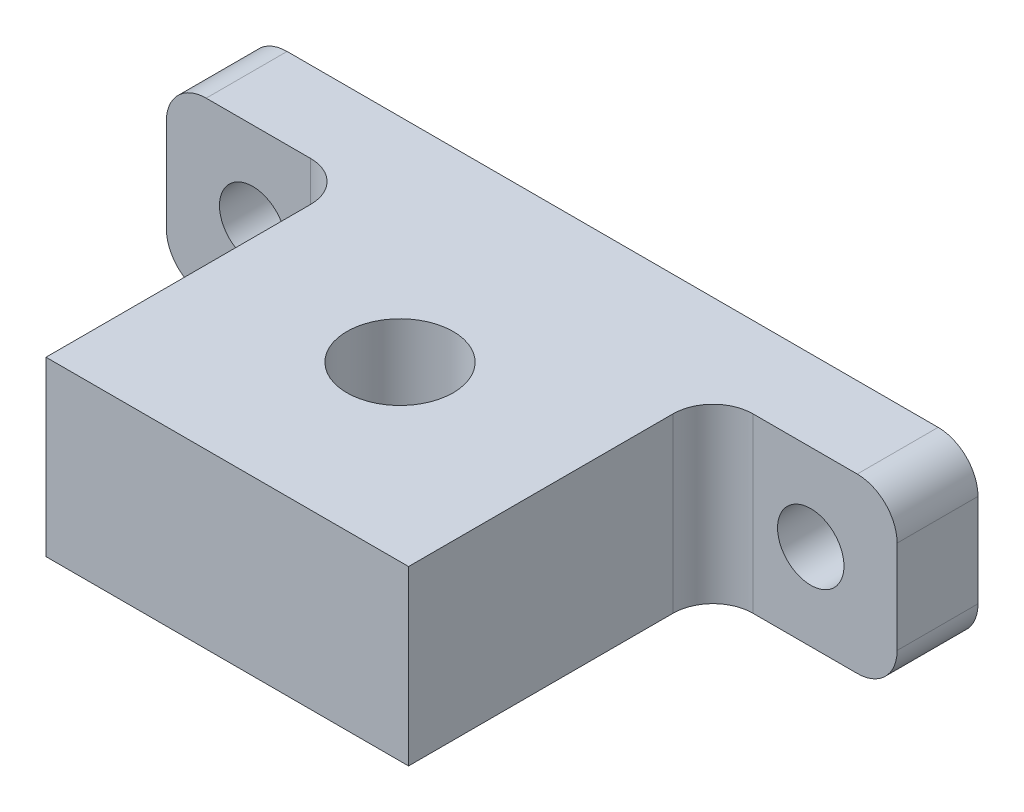
from build123d import *

# Parameters (mm, degrees)
ESBO_O2_R                = 2.5
RESSALTO_EXTRUS_O1_DEPTH = 29
ESBO_O3_R                = 4
CORTE_EXTRUS_O1_DEPTH    = 43.026777178


with BuildPart() as part:
    # Esboço2 → Ressalto-extrusão1 (new body)
    with BuildSketch(Plane.XY):
        with BuildLine():
            Line((-27.5, -3.5), (-27.5, 3.5))
            ThreePointArc((-27.5, 3.5), (-26.621320344, 5.621320344), (-24.5, 6.5))
            Line((-24.5, 6.5), (24.5, 6.5))
            ThreePointArc((24.5, 6.5), (26.621320344, 5.621320344), (27.5, 3.5))
            Line((27.5, 3.5), (27.5, -3.5))
            ThreePointArc((27.5, -3.5), (26.621320344, -5.621320344), (24.5, -6.5))
            Line((24.5, -6.5), (-24.5, -6.5))
            ThreePointArc((-24.5, -6.5), (-26.621320344, -5.621320344), (-27.5, -3.5))
        make_face()
        with Locations(Location((-21, 0, 0), (0, 0, 180))):
            Circle(ESBO_O2_R, mode=Mode.SUBTRACT)
        with Locations(Location((21, 0, 0), (0, 0, 180))):
            Circle(ESBO_O2_R, mode=Mode.SUBTRACT)
    extrude(amount=RESSALTO_EXTRUS_O1_DEPTH)

    # Esboço3 → Corte-extrusão1 (cut, through all)
    with BuildSketch(Plane.XZ.offset(6.5)):
        with Locations((0, 16)):
            Circle(ESBO_O3_R)
        with BuildLine():
            Line((-27.5, 29), (-13.643156348, 29))
            Line((-13.643156348, 29), (-13.643156348, 9.087055385))
            ThreePointArc((-13.643156348, 9.087055385), (-14.521836004, 6.965735042), (-16.643156348, 6.087055385))
            Line((-16.643156348, 6.087055385), (-27.5, 6.087055385))
            Line((-27.5, 6.087055385), (-27.5, 29))
        make_face()
        with BuildLine():
            Line((27.5, 6.087055385), (16.643156348, 6.087055385))
            ThreePointArc((16.643156348, 6.087055385), (14.521836004, 6.965735042), (13.643156348, 9.087055385))
            Line((13.643156348, 9.087055385), (13.643156348, 29))
            Line((13.643156348, 29), (27.5, 29))
            Line((27.5, 29), (27.5, 6.087055385))
        make_face()
    extrude(amount=-CORTE_EXTRUS_O1_DEPTH, mode=Mode.SUBTRACT)


solid = part.part
